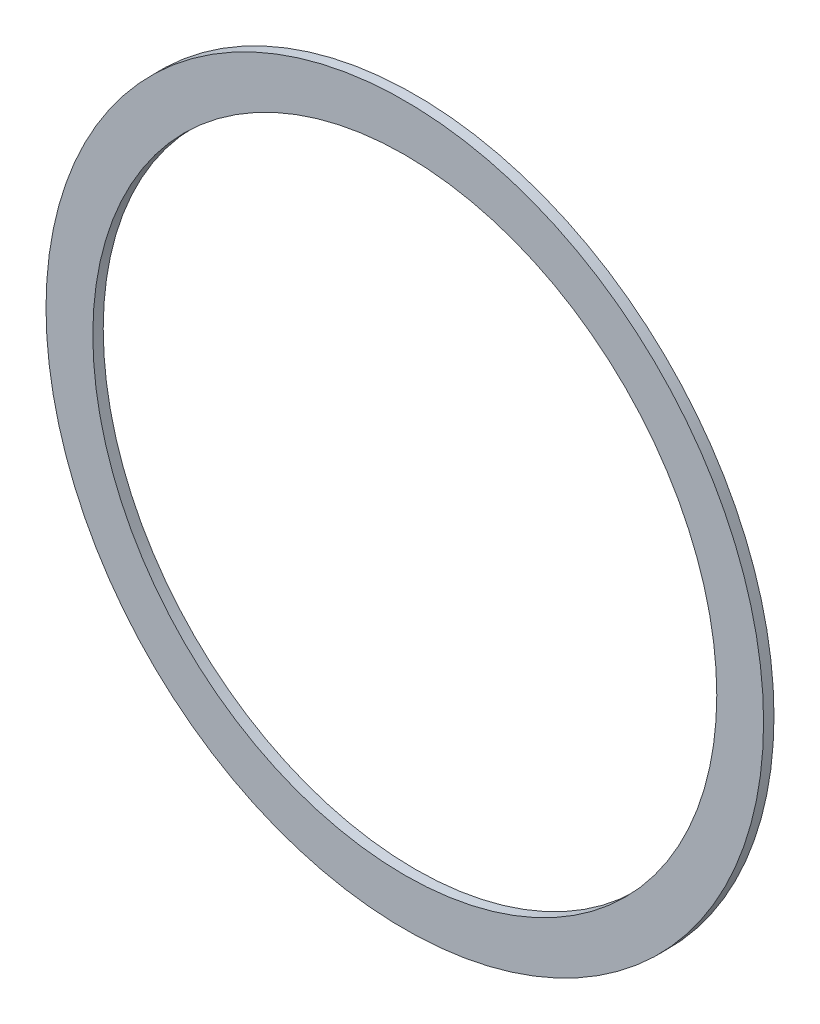
from build123d import *

# Parameters (mm, degrees)
SKETCH1_R           = 69
SKETCH1_R_2         = 60
BOSS_EXTRUDE1_DEPTH = 2


with BuildPart() as part:
    # Sketch1 → Boss-Extrude1 (new body)
    with BuildSketch(Plane.XY):
        Circle(SKETCH1_R)
        Circle(SKETCH1_R_2, mode=Mode.SUBTRACT)
    extrude(amount=BOSS_EXTRUDE1_DEPTH)


solid = part.part
